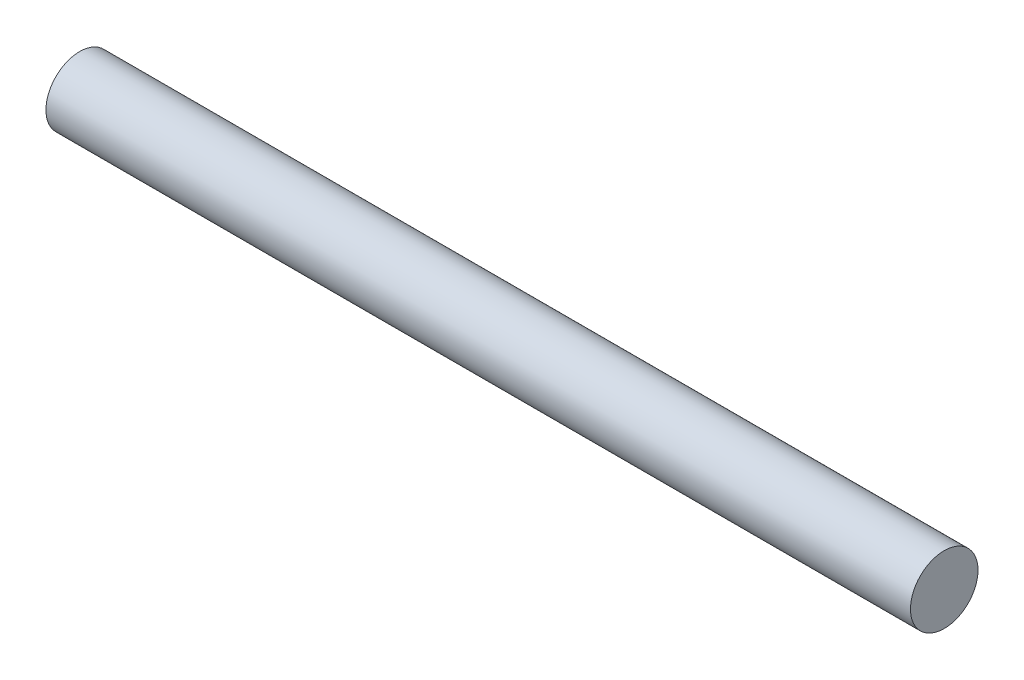
from build123d import *

# Parameters (mm, degrees)
SKETCH1_R           = 2.5
BOSS_EXTRUDE1_DEPTH = 64


with BuildPart() as part:
    # Sketch1 → Boss-Extrude1 (new body)
    with BuildSketch(Plane(origin=(0, 0, 0), x_dir=(0, 0, -1), z_dir=(1, 0, 0))):
        Circle(SKETCH1_R)
    extrude(amount=BOSS_EXTRUDE1_DEPTH)


solid = part.part
